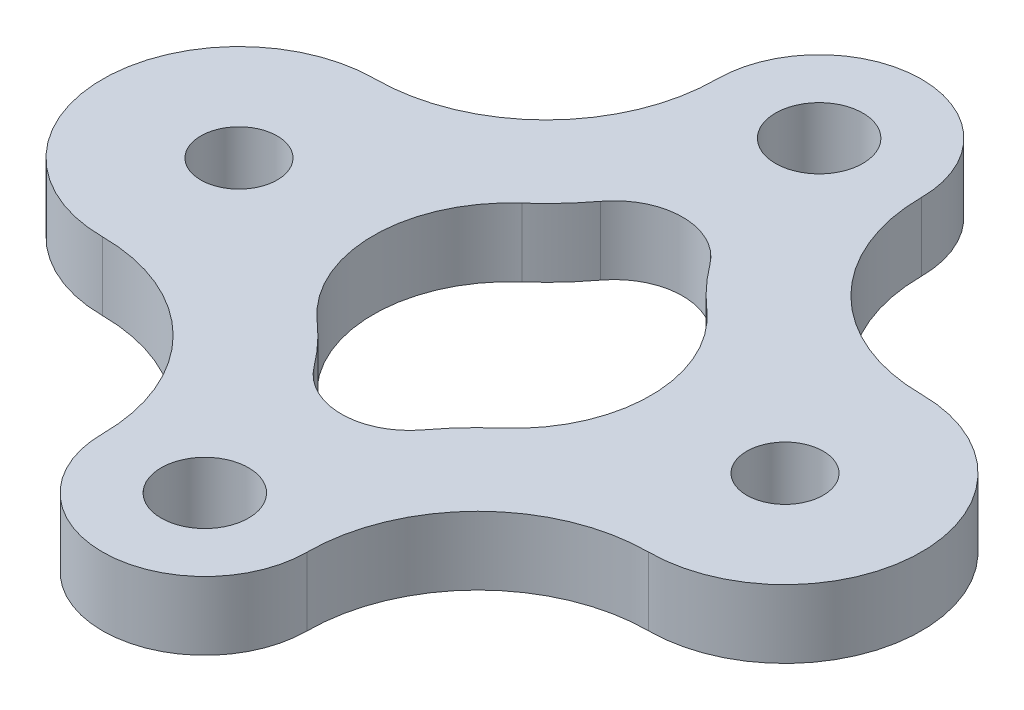
from build123d import *

# Parameters (mm, degrees)
BOSS_EXTRUDE1_DEPTH = 3.175254
SKETCH2_R           = 2.032
SKETCH2_R_2         = 1.778
CUT_EXTRUDE1_DEPTH  = 43.71527523
CUT_EXTRUDE2_DEPTH  = 43.71527523


with BuildPart() as part:
    # Sketch1 → Boss-Extrude1 (new body)
    with BuildSketch(Plane(origin=(0, 0, 0), x_dir=(1, 0, 0), z_dir=(0, 1, 0))):
        with BuildLine():
            ThreePointArc((4.7625, -4.7625), (0, 0), (-4.7625, -4.7625))
            ThreePointArc((-4.7625, -4.7625), (-7.087339924, -10.375160076), (-12.7, -12.7))
            ThreePointArc((-12.7, -12.7), (-19.05, -19.05), (-12.7, -25.4))
            ThreePointArc((-12.7, -25.4), (-7.087339924, -27.724839924), (-4.7625, -33.3375))
            ThreePointArc((-4.7625, -33.3375), (0, -38.1), (4.7625, -33.3375))
            ThreePointArc((4.7625, -33.3375), (7.087339924, -27.724839924), (12.7, -25.4))
            ThreePointArc((12.7, -25.4), (19.05, -19.05), (12.7, -12.7))
            ThreePointArc((12.7, -12.7), (7.087339924, -10.375160076), (4.7625, -4.7625))
        make_face()
    extrude(amount=BOSS_EXTRUDE1_DEPTH)

    # Sketch2 → Cut-Extrude1 (cut, through all)
    with BuildSketch(Plane(origin=(0, 3.175254, 0), x_dir=(1, 0, 0), z_dir=(0, 1, 0))):
        with Locations(Location((0, -4.7625, 0), (0, 0, 270))):
            Circle(SKETCH2_R)
        with Locations(Location((12.7, -19.05, 0), (0, 0, 270))):
            Circle(SKETCH2_R_2)
        with Locations(Location((0, -33.3375, 0), (0, 0, 270))):
            Circle(SKETCH2_R)
        with Locations(Location((-12.7, -19.05, 0), (0, 0, 270))):
            Circle(SKETCH2_R_2)
    extrude(amount=-CUT_EXTRUDE1_DEPTH, mode=Mode.SUBTRACT)

    # Sketch3 → Cut-Extrude2 (cut, through all)
    with BuildSketch(Plane(origin=(0, 3.175254, 0), x_dir=(1, 0, 0), z_dir=(0, 1, 0))):
        with BuildLine():
            ThreePointArc((-4.299739587, -14.2875), (-6.449609381, -19.05), (-4.299739587, -23.8125))
            ThreePointArc((-4.299739587, -23.8125), (-3.371116203, -24.719963977), (-2.54, -25.7175))
            ThreePointArc((-2.54, -25.7175), (0, -26.9875), (2.54, -25.7175))
            ThreePointArc((2.54, -25.7175), (3.371116203, -24.719963977), (4.299739587, -23.8125))
            ThreePointArc((4.299739587, -23.8125), (6.449609381, -19.05), (4.299739587, -14.2875))
            ThreePointArc((4.299739587, -14.2875), (3.371116203, -13.380036023), (2.54, -12.3825))
            ThreePointArc((2.54, -12.3825), (0, -11.1125), (-2.54, -12.3825))
            ThreePointArc((-2.54, -12.3825), (-3.371116203, -13.380036023), (-4.299739587, -14.2875))
        make_face()
    extrude(amount=-CUT_EXTRUDE2_DEPTH, mode=Mode.SUBTRACT)


solid = part.part
